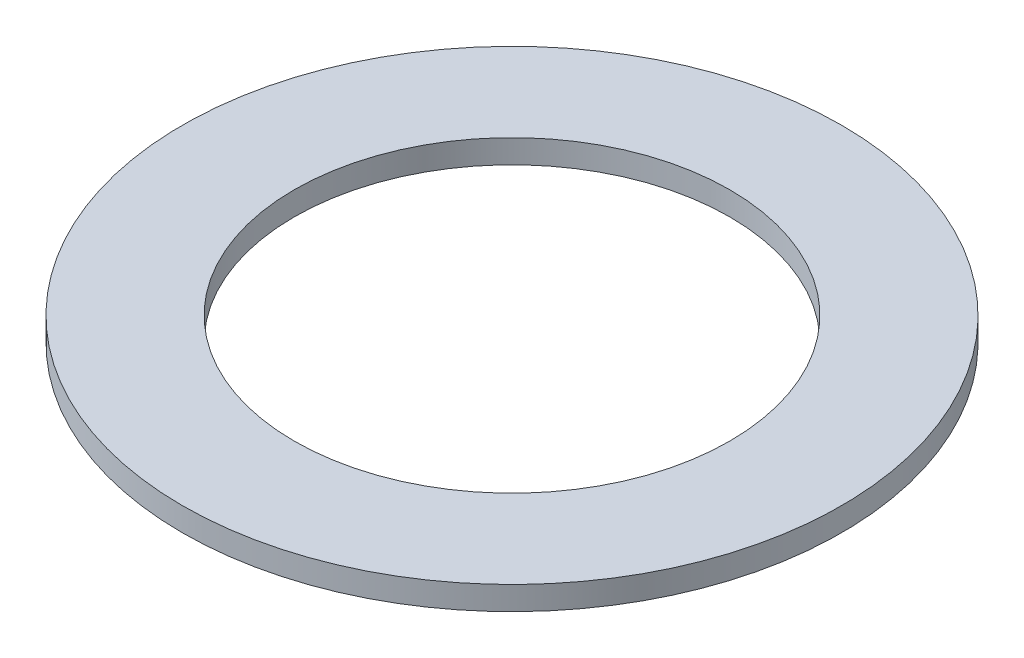
from build123d import *

# Parameters (mm, degrees)
SKETCH_1_R      = 28
SKETCH_1_R_2    = 18.5
EXTRUDE_1_DEPTH = 2


with BuildPart() as part:
    # 草图1 → 凸台-拉伸1 (new body)
    with BuildSketch(Plane(origin=(0, 0, 0), x_dir=(1, 0, 0), z_dir=(0, 1, 0))):
        with Locations(Location((0, 0, 0), (0, 0, 270))):
            Circle(SKETCH_1_R)
        with Locations(Location((0, 0, 0), (0, 0, 270))):
            Circle(SKETCH_1_R_2, mode=Mode.SUBTRACT)
    extrude(amount=EXTRUDE_1_DEPTH)


solid = part.part
